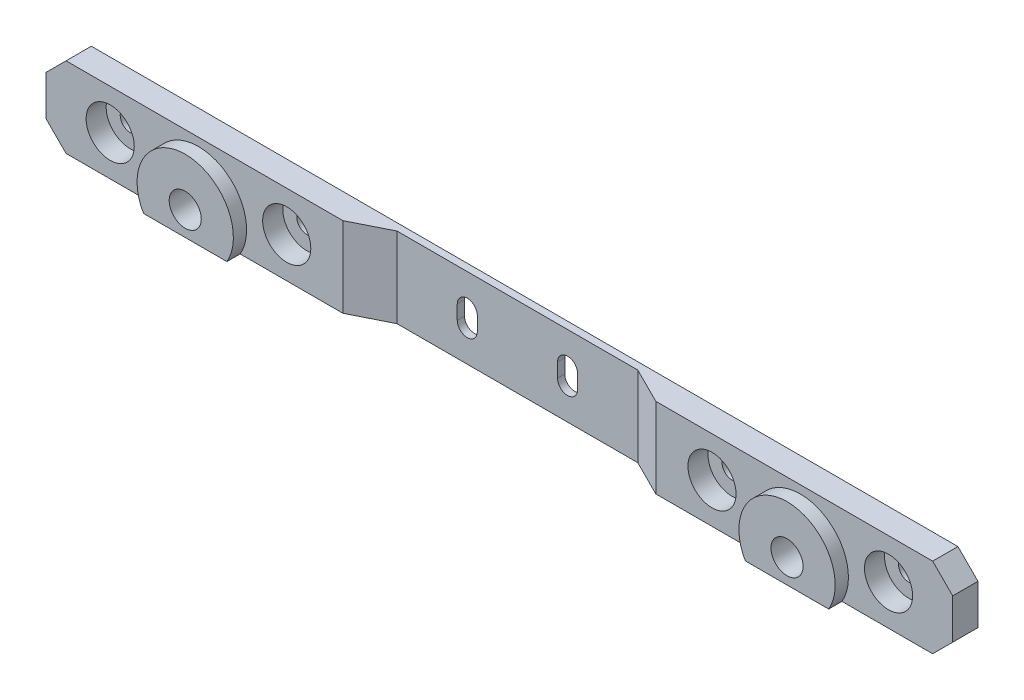
from build123d import *

# Parameters (mm, degrees)
SKETCH1_R           = 4
SKETCH1_R_2         = 2.5
BOSS_EXTRUDE1_DEPTH = 9.6
CUT_EXTRUDE1_START  = -3.3
SKETCH2_R           = 2.5
CUT_EXTRUDE1_DEPTH  = 3.3
CUT_EXTRUDE2_DEPTH  = 228.086239125
SKETCH5_R           = 6
CUT_EXTRUDE3_DEPTH  = 5


with BuildPart() as part:
    # Sketch1 → Boss-Extrude1 (new body)
    with BuildSketch(Plane.XY):
        Polygon((221, 0), (5, 0), (0, -5), (0, -15), (5, -20), (221, -20), (226, -15), (226, -5), align=None)
        with Locations((38, -14)):
            Circle(SKETCH1_R, mode=Mode.SUBTRACT)
        with Locations((188, -14)):
            Circle(SKETCH1_R, mode=Mode.SUBTRACT)
        with Locations((16, -10)):
            Circle(SKETCH1_R_2, mode=Mode.SUBTRACT)
        with Locations((60, -10)):
            Circle(SKETCH1_R_2, mode=Mode.SUBTRACT)
        with BuildLine():
            ThreePointArc((98, -8.25), (100.5, -5.75), (103, -8.25))
            Line((103, -8.25), (103, -11.75))
            ThreePointArc((103, -11.75), (100.5, -14.25), (98, -11.75))
            Line((98, -11.75), (98, -8.25))
        make_face(mode=Mode.SUBTRACT)
        with BuildLine():
            Line((128, -8.25), (128, -11.75))
            ThreePointArc((128, -11.75), (125.5, -14.25), (123, -11.75))
            Line((123, -11.75), (123, -8.25))
            ThreePointArc((123, -8.25), (125.5, -5.75), (128, -8.25))
        make_face(mode=Mode.SUBTRACT)
        with Locations((166, -10)):
            Circle(SKETCH1_R_2, mode=Mode.SUBTRACT)
        with Locations((210, -10)):
            Circle(SKETCH1_R_2, mode=Mode.SUBTRACT)
    extrude(amount=BOSS_EXTRUDE1_DEPTH)

    # Sketch2 → Cut-Extrude1 (cut)
    # profile 1 of 2: a face of its own
    with BuildSketch(Plane.XY.offset(9.6).offset(CUT_EXTRUDE1_START)):
        with BuildLine():
            Line((48.392304845, -20), (113, -20))
            Line((113, -20), (113, 0))
            Line((113, 0), (5, 0))
            Line((5, 0), (0, -5))
            Line((0, -5), (0, -15))
            Line((0, -15), (5, -20))
            Line((5, -20), (27.607695155, -20))
            ThreePointArc((27.607695155, -20), (34.894171459, -2.408890085), (50, -14))
            ThreePointArc((50, -14), (49.591109915, -17.105828541), (48.392304845, -20))
        make_face()
        with Locations((16, -10)):
            Circle(SKETCH2_R, mode=Mode.SUBTRACT)
        with Locations((60, -10)):
            Circle(SKETCH2_R, mode=Mode.SUBTRACT)
        with BuildLine():
            Line((98, -11.75), (98, -8.25))
            ThreePointArc((98, -8.25), (100.5, -5.75), (103, -8.25))
            Line((103, -8.25), (103, -11.75))
            ThreePointArc((103, -11.75), (100.5, -14.25), (98, -11.75))
        make_face(mode=Mode.SUBTRACT)
    # profile 2 of 2: a face of its own
    with BuildSketch(Plane.XY.offset(9.6).offset(CUT_EXTRUDE1_START)):
        with BuildLine():
            Line((113, 0), (113, -20))
            Line((113, -20), (177.607695155, -20))
            ThreePointArc((177.607695155, -20), (184.894171459, -2.408890085), (200, -14))
            ThreePointArc((200, -14), (199.591109915, -17.105828541), (198.392304845, -20))
            Line((198.392304845, -20), (221, -20))
            Line((221, -20), (226, -15))
            Line((226, -15), (226, -5))
            Line((226, -5), (221, 0))
            Line((221, 0), (113, 0))
        make_face()
        with BuildLine():
            Line((123, -11.75), (123, -8.25))
            ThreePointArc((123, -8.25), (125.5, -5.75), (128, -8.25))
            Line((128, -8.25), (128, -11.75))
            ThreePointArc((128, -11.75), (125.5, -14.25), (123, -11.75))
        make_face(mode=Mode.SUBTRACT)
        with Locations((166, -10)):
            Circle(SKETCH2_R, mode=Mode.SUBTRACT)
        with Locations((210, -10)):
            Circle(SKETCH2_R, mode=Mode.SUBTRACT)
    extrude(amount=CUT_EXTRUDE1_DEPTH, mode=Mode.SUBTRACT)

    # Sketch4 → Cut-Extrude2 (cut, through all)
    with BuildSketch(Plane.XZ.offset(20)):
        Polygon((143, 1.8), (152, 6.3), (113, 6.3), (74, 6.3), (83, 1.8), align=None)
    extrude(amount=-CUT_EXTRUDE2_DEPTH, mode=Mode.SUBTRACT)

    # Sketch5 → Cut-Extrude3 (cut)
    with BuildSketch(Plane.XY.offset(6.3)):
        with Locations((16, -10)):
            Circle(SKETCH5_R)
        with Locations((60, -10)):
            Circle(SKETCH5_R)
        with Locations((166, -10)):
            Circle(SKETCH5_R)
        with Locations((210, -10)):
            Circle(SKETCH5_R)
    extrude(amount=-CUT_EXTRUDE3_DEPTH, mode=Mode.SUBTRACT)


solid = part.part
